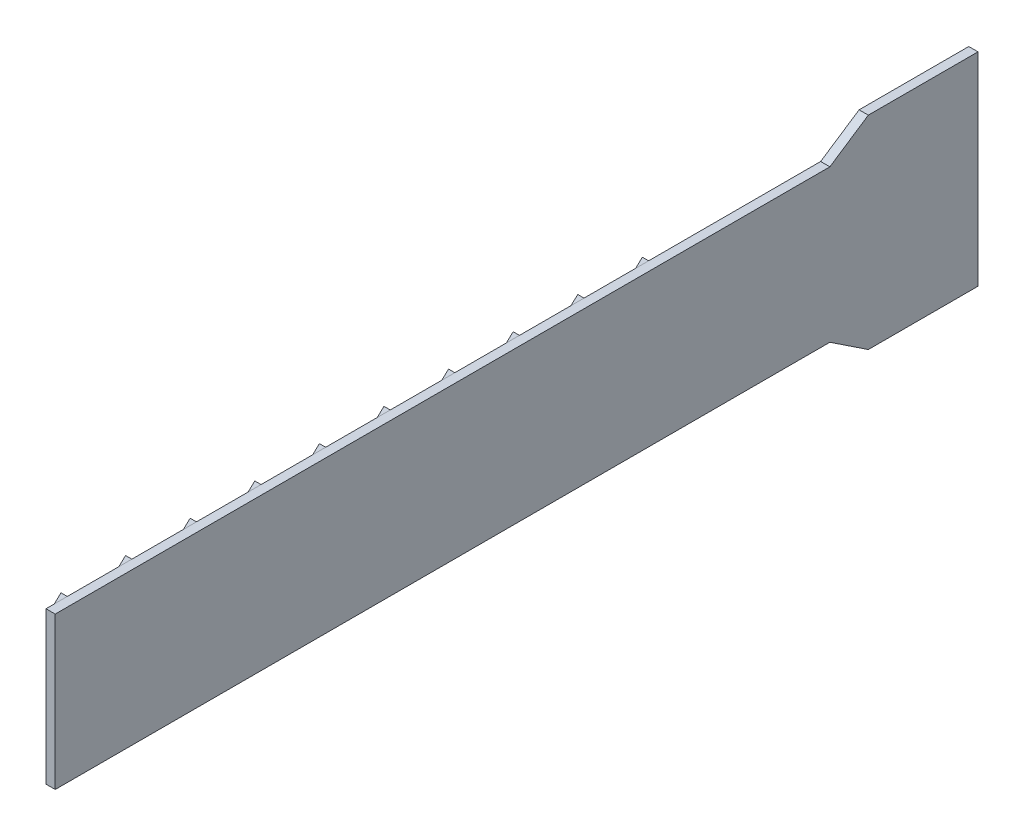
from build123d import *

# Parameters (mm, degrees)
BOSS_EXTRUDE1_DEPTH = 10
BOSS_EXTRUDE2_DEPTH = 164
LPATTERN1_COUNT     = 10
LPATTERN1_PITCH     = 70


with BuildPart() as part:
    # Sketch5 → Boss-Extrude1 (new body)
    with BuildSketch(Plane(origin=(10, 0, 0), x_dir=(0, 0, -1), z_dir=(1, 0, 0))):
        Polygon((1000, 220), (1000, 0), (881.128856778, 0), (839.480242444, 27.665735559), (0, 27.665735559), (0, 192.334264441), (839.480242444, 192.334264441), (881.128856778, 220), align=None)
    extrude(amount=BOSS_EXTRUDE1_DEPTH)

    # Sketch6 → Boss-Extrude2 (add)
    with BuildSketch(Plane(origin=(0, 27.665735559, 0), x_dir=(-1, 0, 0), z_dir=(0, -1, 0))):
        Polygon((-10, 23.738513139), (-2.5, 23.738513139), (-10, 8.259066754), align=None)
    boss_extrude2 = extrude(amount=-BOSS_EXTRUDE2_DEPTH)

    # LPattern1: Boss-Extrude2 ×10
    with Locations(*[(0, 0, -i * LPATTERN1_PITCH) for i in range(1, LPATTERN1_COUNT)]):
        add(boss_extrude2)


solid = part.part
